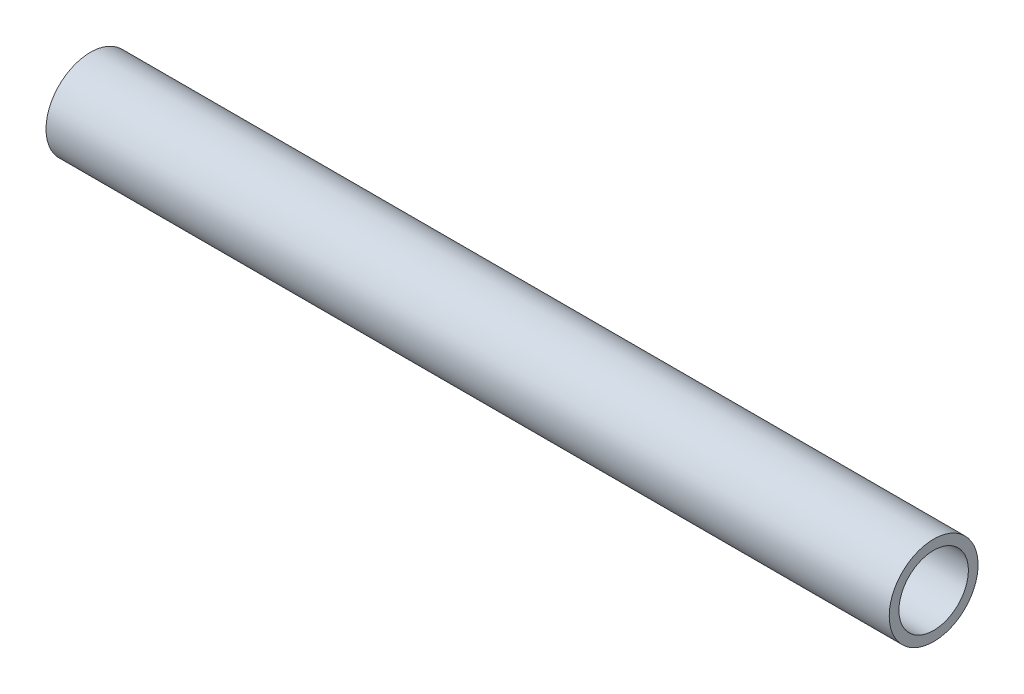
from build123d import *

# Parameters (mm, degrees)
HOSE_8_SKETCH_W = 130
HOSE_8_SKETCH_H = 1.5


with BuildPart() as part:
    # Hose_8 Sketch → Hose_8 (revolve)
    with BuildSketch(Plane.XY):
        with Locations((0, 6.1)):
            Rectangle(HOSE_8_SKETCH_W, HOSE_8_SKETCH_H)
    revolve(axis=Axis((-1000, 0, 0), (1, 0, 0)))


solid = part.part
